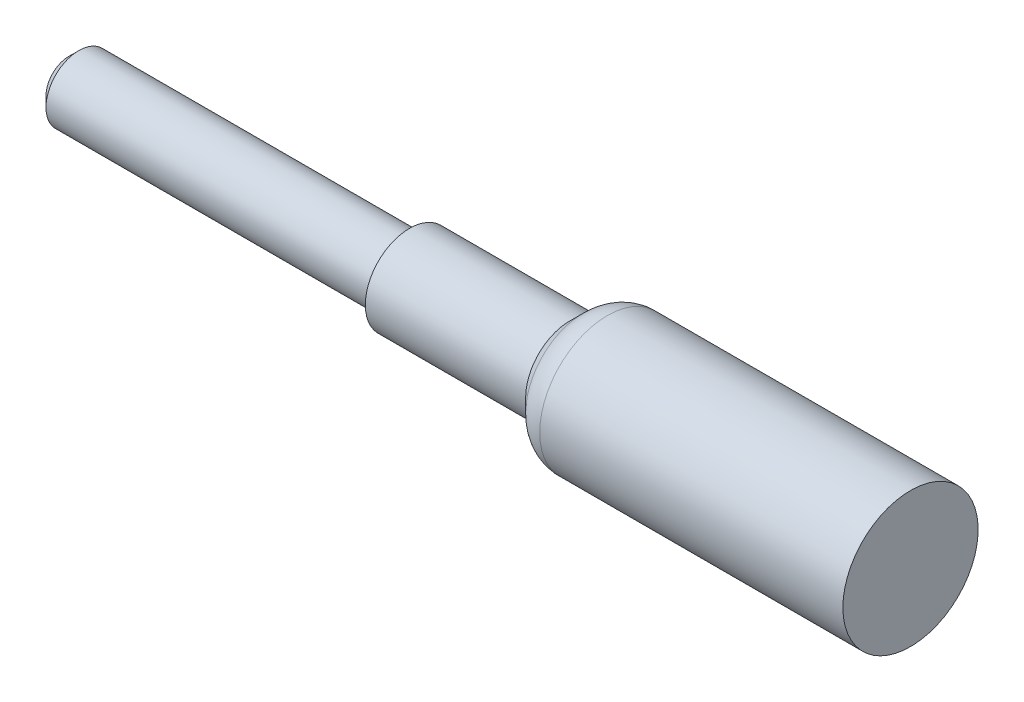
from build123d import *

# Parameters (mm, degrees)
FILLET1_R           = 2.159
SKETCH6_R           = 2.0828
BOSS_EXTRUDE1_DEPTH = 21.59
CHAMFER2_SIZE       = 0.635


with BuildPart() as part:
    # Sketch1 → Revolve1 (revolve)
    with BuildSketch(Plane.XY, mode=Mode.PRIVATE) as revolve1_sk:
        Polygon((31.75, 0), (31.75, 4.28625), (11.64625, 4.28625), (10.16, 2.8), (0, 2.8), (0, 0), align=None)
    revolve(revolve1_sk.sketch.rotate(Axis((0, 0, 0), (1, 0, 0)), 90), axis=Axis((0, 0, 0), (1, 0, 0)))

    # Fillet1
    fillet1_edges = [part.edges().sort_by_distance(p)[0] for p in [
        (11.64625, 0, -4.28625),
    ]]
    fillet(fillet1_edges, radius=FILLET1_R)

    # Sketch6 → Boss-Extrude1 (add)
    with BuildSketch(Plane.ZY):
        Circle(SKETCH6_R)
    extrude(amount=BOSS_EXTRUDE1_DEPTH)

    # Chamfer2
    chamfer2_edges = [part.edges().sort_by_distance(p)[0] for p in [
        (-21.59, 0, -2.0828),
    ]]
    chamfer(chamfer2_edges, length=CHAMFER2_SIZE)


solid = part.part
